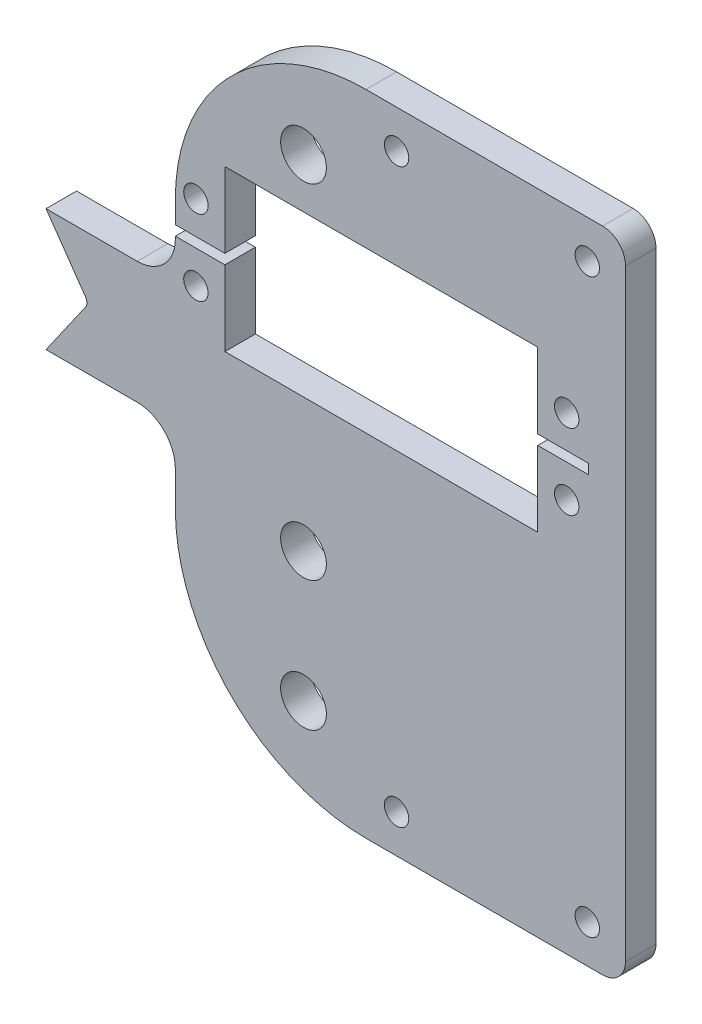
from build123d import *

# Parameters (mm, degrees)
SKETCH_1_W          = 59
SKETCH_1_H          = 85
SKETCH_1_W_2        = 41
SKETCH_1_H_2        = 21
EXTRUDE_1_DEPTH     = 4
SKETCH_2_R          = 1.6
SKETCH_2_W          = 6.65
SKETCH_2_H          = 1.3
CUT_EXTRUDE_1_DEPTH = 4
SKETCH_5_R          = 3
CUT_EXTRUDE_4_DEPTH = 10
SKETCH_3_R          = 3
CUT_EXTRUDE_2_DEPTH = 4
FILLET_1_R          = 25
FILLET_2_R          = 3
SKETCH_4_R          = 1.6
CUT_EXTRUDE_3_DEPTH = 10
EXTRUDE_2_DEPTH     = 4
FILLET_3_R          = 1
FILLET_4_R          = 5
SKETCH_8_R          = 1.6
CUT_EXTRUDE_5_DEPTH = 10


with BuildPart() as part:
    # ｽｹｯﾁ1 → ﾎﾞｽ - 押し出し1 (new body)
    with BuildSketch(Plane.XY):
        with Locations((2.5, 11.5)):
            Rectangle(SKETCH_1_W, SKETCH_1_H)
        with Locations((0, 25.5)):
            Rectangle(SKETCH_1_W_2, SKETCH_1_H_2, mode=Mode.SUBTRACT)
    extrude(amount=EXTRUDE_1_DEPTH)

    # ｽｹｯﾁ2 → ｶｯﾄ - 押し出し1 (cut)
    with BuildSketch(Plane(origin=(0, 0, 0), x_dir=(-1, 0, 0), z_dir=(0, 0, -1))):
        with Locations((-24.3, 20.55)):
            Circle(SKETCH_2_R)
        with Locations((-24.3, 30.45)):
            Circle(SKETCH_2_R)
        with Locations((24.3, 30.45)):
            Circle(SKETCH_2_R)
        with Locations((24.3, 20.55)):
            Circle(SKETCH_2_R)
        with Locations((-23.825, 25.5)):
            Rectangle(SKETCH_2_W, SKETCH_2_H)
        with Locations((23.825, 25.5)):
            Rectangle(SKETCH_2_W, SKETCH_2_H)
    extrude(amount=-CUT_EXTRUDE_1_DEPTH, mode=Mode.SUBTRACT)

    # ｽｹｯﾁ5 → ｶｯﾄ - 押し出し4 (cut)
    with BuildSketch(Plane.XY.offset(4)):
        with Locations((-10.2, -2.5)):
            Circle(SKETCH_5_R)
    extrude(amount=-CUT_EXTRUDE_4_DEPTH, mode=Mode.SUBTRACT)

    # ｽｹｯﾁ3 → ｶｯﾄ - 押し出し2 (cut)
    with BuildSketch(Plane.XY.offset(4)):
        with Locations((-10.2, 42.5)):
            Circle(SKETCH_3_R)
        with Locations((-10.2, -19.5)):
            Circle(SKETCH_3_R)
    extrude(amount=-CUT_EXTRUDE_2_DEPTH, mode=Mode.SUBTRACT)

    # ﾌｨﾚｯﾄ1
    fillet_1_edges = [part.edges().sort_by_distance(p)[0] for p in [
        (-27, 54, 2),
        (-27, -31, 2),
    ]]
    fillet(fillet_1_edges, radius=FILLET_1_R)

    # ﾌｨﾚｯﾄ2
    fillet_2_edges = [part.edges().sort_by_distance(p)[0] for p in [
        (32, 54, 2),
        (32, -31, 2),
    ]]
    fillet(fillet_2_edges, radius=FILLET_2_R)

    # ｽｹｯﾁ4 → ｶｯﾄ - 押し出し3 (cut)
    with BuildSketch(Plane.XY.offset(4)):
        with Locations((27, 49)):
            Circle(SKETCH_4_R)
        with Locations((27, -26)):
            Circle(SKETCH_4_R)
    extrude(amount=-CUT_EXTRUDE_3_DEPTH, mode=Mode.SUBTRACT)

    # ｽｹｯﾁ6 → ﾎﾞｽ - 押し出し2 (add)
    with BuildSketch(Plane.XY.offset(4)):
        Polygon((-27, 19.5), (-43.945270358, 19.5), (-38.364198183, 11.5), (-43.945270358, 3.5), (-27, 3.5), align=None)
    extrude(amount=-EXTRUDE_2_DEPTH)

    # ﾌｨﾚｯﾄ3
    fillet_3_edges = [part.edges().sort_by_distance(p)[0] for p in [
        (-38.364198183, 11.5, 2),
    ]]
    fillet(fillet_3_edges, radius=FILLET_3_R)

    # ﾌｨﾚｯﾄ4
    fillet_4_edges = [part.edges().sort_by_distance(p)[0] for p in [
        (-27, 19.5, 2),
        (-27, 3.5, 2),
    ]]
    fillet(fillet_4_edges, radius=FILLET_4_R)

    # ｽｹｯﾁ8 → ｶｯﾄ - 押し出し5 (cut)
    with BuildSketch(Plane.XY.offset(4)):
        with Locations((2, -26)):
            Circle(SKETCH_8_R)
        with Locations((2, 49)):
            Circle(SKETCH_8_R)
    extrude(amount=-CUT_EXTRUDE_5_DEPTH, mode=Mode.SUBTRACT)


solid = part.part
